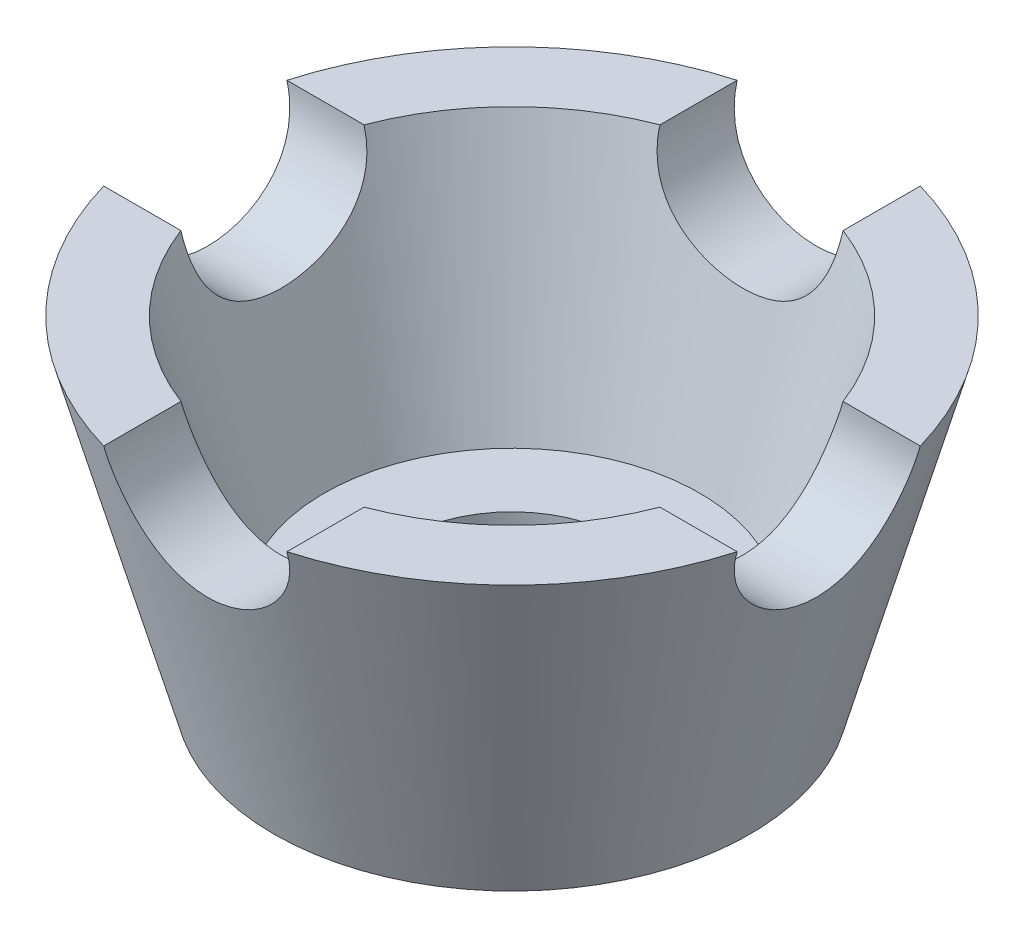
from build123d import *

# Parameters (mm, degrees)
CUT_EXTRUDE1_DEPTH      = 63.353829072
CUT_EXTRUDE1_DEPTH_BACK = 63.353829072
CUT_EXTRUDE2_DEPTH      = 62.546730387
CUT_EXTRUDE2_DEPTH_BACK = 62.546730387


with BuildPart() as part:
    # Sketch1 → Revolve1 (revolve)
    with BuildSketch(Plane.XY, mode=Mode.PRIVATE) as revolve1_sk:
        Polygon((12, 0), (26, 0), (36, 36), (28, 36), (20.5, 9), (12, 9), align=None)
    revolve(revolve1_sk.sketch.rotate(Axis((0, 54.736842105, 0), (0, -1, 0)), 90), axis=Axis((0, 54.736842105, 0), (0, -1, 0)))

    # Sketch2 → Cut-Extrude1 (cut, two sides: drawn at the far end of the back side and taken through both)
    with BuildSketch(Plane(origin=(0, 0, 0), x_dir=(0, 0, -1), z_dir=(1, 0, 0)).offset(-CUT_EXTRUDE1_DEPTH_BACK)):
        with BuildLine():
            Line((-10, 36), (10, 36))
            ThreePointArc((10, 36), (0, 26), (-10, 36))
        make_face()
    extrude(amount=CUT_EXTRUDE1_DEPTH + CUT_EXTRUDE1_DEPTH_BACK, mode=Mode.SUBTRACT)

    # Sketch3 → Cut-Extrude2 (cut, two sides: drawn at the far end of the back side and taken through both)
    with BuildSketch(Plane.XY.offset(-CUT_EXTRUDE2_DEPTH_BACK)):
        with BuildLine():
            Line((-10, 36), (10, 36))
            ThreePointArc((10, 36), (0, 26), (-10, 36))
        make_face()
    extrude(amount=CUT_EXTRUDE2_DEPTH + CUT_EXTRUDE2_DEPTH_BACK, mode=Mode.SUBTRACT)


solid = part.part
